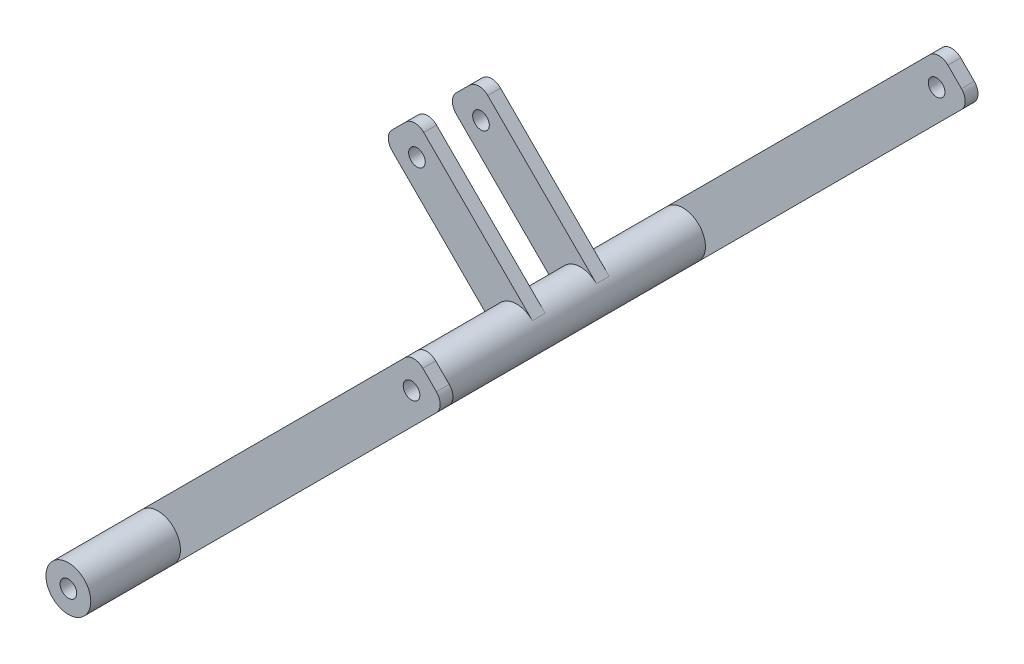
from build123d import *

# Parameters (mm, degrees)
SKETCH1_R           = 17.5
SKETCH1_R_2         = 6.5
BOSS_EXTRUDE1_DEPTH = 280
SKETCH2_R           = 6.5
BOSS_EXTRUDE2_DEPTH = 10
SKETCH3_R           = 6.5
BOSS_EXTRUDE3_DEPTH = 10


with BuildPart() as part:
    # Sketch1 → Boss-Extrude1 (new, symmetric)
    with BuildSketch(Plane.XY):
        Circle(SKETCH1_R)
        Circle(SKETCH1_R_2, mode=Mode.SUBTRACT)
    extrude(amount=BOSS_EXTRUDE1_DEPTH, both=True)

    # Sketch2 → Boss-Extrude2 (add)
    with BuildSketch(Plane.XY.offset(210)):
        with BuildLine():
            Line((-12.374368671, 12.374368671), (192.686597873, 217.435335215))
            ThreePointArc((192.686597873, 217.435335215), (199.757665685, 220.364267403), (206.828733497, 217.435335215))
            Line((206.828733497, 217.435335215), (217.435335215, 206.828733497))
            ThreePointArc((217.435335215, 206.828733497), (220.364267403, 199.757665685), (217.435335215, 192.686597873))
            Line((217.435335215, 192.686597873), (12.374368671, -12.374368671))
            ThreePointArc((12.374368671, -12.374368671), (12.374368671, 12.374368671), (-12.374368671, 12.374368671))
        make_face()
        with Locations((197.989898732, 197.989898732)):
            Circle(SKETCH2_R, mode=Mode.SUBTRACT)
    boss_extrude2 = extrude(amount=-BOSS_EXTRUDE2_DEPTH)

    # Mirror1: Boss-Extrude2 across plane
    add(boss_extrude2.mirror(Plane.XY))


with BuildPart() as body_2:
    # Sketch3 → Boss-Extrude3 (new body)
    with BuildSketch(Plane.XY.offset(-120)):
        with BuildLine():
            Line((12.374368671, 12.374368671), (-72.478445072, 97.227182413))
            ThreePointArc((-72.478445072, 97.227182413), (-79.549512883, 100.156114601), (-86.620580695, 97.227182413))
            Line((-86.620580695, 97.227182413), (-97.227182413, 86.620580695))
            ThreePointArc((-97.227182413, 86.620580695), (-100.156114601, 79.549512883), (-97.227182413, 72.478445072))
            Line((-97.227182413, 72.478445072), (-12.374368671, -12.374368671))
            ThreePointArc((-12.374368671, -12.374368671), (-12.374368671, 12.374368671), (12.374368671, 12.374368671))
        make_face()
        with Locations((-77.781745931, 77.781745931)):
            Circle(SKETCH3_R, mode=Mode.SUBTRACT)
    extrude(amount=-BOSS_EXTRUDE3_DEPTH)


with BuildPart() as body_3:
    # Mirror2: mirrored copy
    add(body_2.part.mirror(Plane(origin=(0, 0, -100), x_dir=(1, 0, 0), z_dir=(0, 0, -1))))


solid = Compound([part.part, body_2.part, body_3.part])
